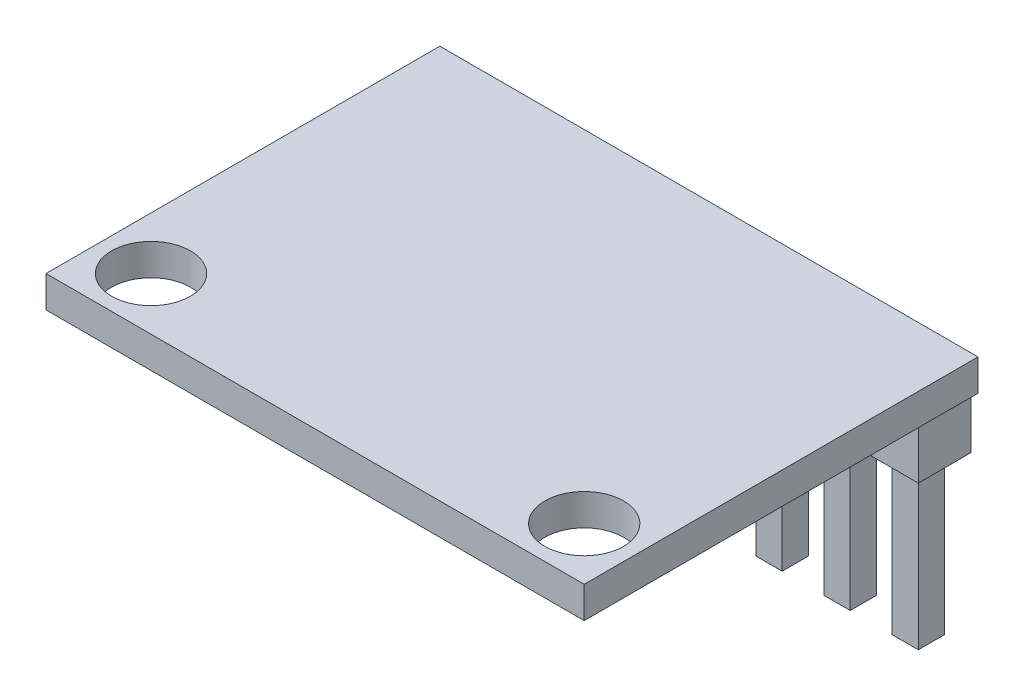
from build123d import *

# Parameters (mm, degrees)
SKETCH1_W           = 20.5
SKETCH1_H           = 15
SKETCH1_R           = 1.5
BOSS_EXTRUDE1_DEPTH = 1.2
SKETCH2_W           = 1
SKETCH2_H           = 1
BOSS_EXTRUDE2_DEPTH = 8
SKETCH3_W           = 20.15
SKETCH3_H           = 2
BOSS_EXTRUDE3_DEPTH = 2


with BuildPart() as part:
    # Sketch1 → Boss-Extrude1 (new body)
    with BuildSketch(Plane(origin=(0, 0, 0), x_dir=(1, 0, 0), z_dir=(0, 1, 0))):
        Rectangle(SKETCH1_W, SKETCH1_H)
        with Locations(Location((-8.25, -5.5, 0), (0, 0, 270))):
            Circle(SKETCH1_R, mode=Mode.SUBTRACT)
        with Locations(Location((8.25, -5.5, 0), (0, 0, 90))):
            Circle(SKETCH1_R, mode=Mode.SUBTRACT)
    extrude(amount=BOSS_EXTRUDE1_DEPTH)

    # Sketch2 → Boss-Extrude2 (add)
    with BuildSketch(Plane(origin=(0, 0, 0), x_dir=(1, 0, 0), z_dir=(0, 1, 0))):
        with Locations((9.075, 6.4)):
            Rectangle(SKETCH2_W, SKETCH2_H)
        with Locations((6.4825, 6.4)):
            Rectangle(SKETCH2_W, SKETCH2_H)
        with Locations((3.89, 6.4)):
            Rectangle(SKETCH2_W, SKETCH2_H)
        with Locations((1.2975, 6.4)):
            Rectangle(SKETCH2_W, SKETCH2_H)
        with Locations((-1.295, 6.4)):
            Rectangle(SKETCH2_W, SKETCH2_H)
        with Locations((-3.8875, 6.4)):
            Rectangle(SKETCH2_W, SKETCH2_H)
        with Locations((-6.48, 6.4)):
            Rectangle(SKETCH2_W, SKETCH2_H)
        with Locations((-9.0725, 6.4)):
            Rectangle(SKETCH2_W, SKETCH2_H)
    extrude(amount=-BOSS_EXTRUDE2_DEPTH)

    # Sketch3 → Boss-Extrude3 (add)
    with BuildSketch(Plane(origin=(0, 0, 0), x_dir=(1, 0, 0), z_dir=(0, 1, 0))):
        with Locations((0, 6.4)):
            Rectangle(SKETCH3_W, SKETCH3_H)
    extrude(amount=-BOSS_EXTRUDE3_DEPTH)


solid = part.part
